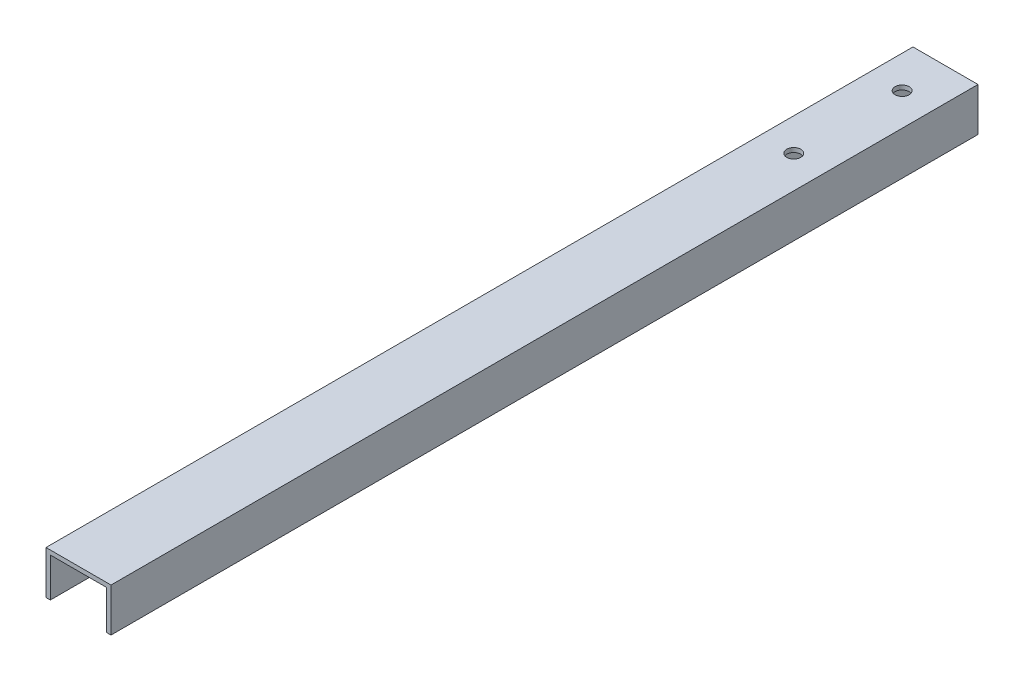
from build123d import *

# Parameters (mm, degrees)
BOSS_EXTRUDE1_DEPTH = 400
SKETCH2_R           = 3.25
CUT_EXTRUDE1_DEPTH  = 300


with BuildPart() as part:
    # Sketch1 → Boss-Extrude1 (new body)
    with BuildSketch(Plane.XY):
        Polygon((28, 0), (30, 0), (30, 20), (0, 20), (0, 0), (2, 0), (2, 18), (28, 18), align=None)
    extrude(amount=BOSS_EXTRUDE1_DEPTH)

    # Sketch2 → Cut-Extrude1 (cut)
    with BuildSketch(Plane(origin=(0, 20, 0), x_dir=(1, 0, 0), z_dir=(0, 1, 0))):
        with Locations(Location((15, -70, 0), (0, 0, 270))):
            Circle(SKETCH2_R)
        with Locations(Location((15, -20, 0), (0, 0, 270))):
            Circle(SKETCH2_R)
    extrude(amount=-CUT_EXTRUDE1_DEPTH, mode=Mode.SUBTRACT)


solid = part.part
